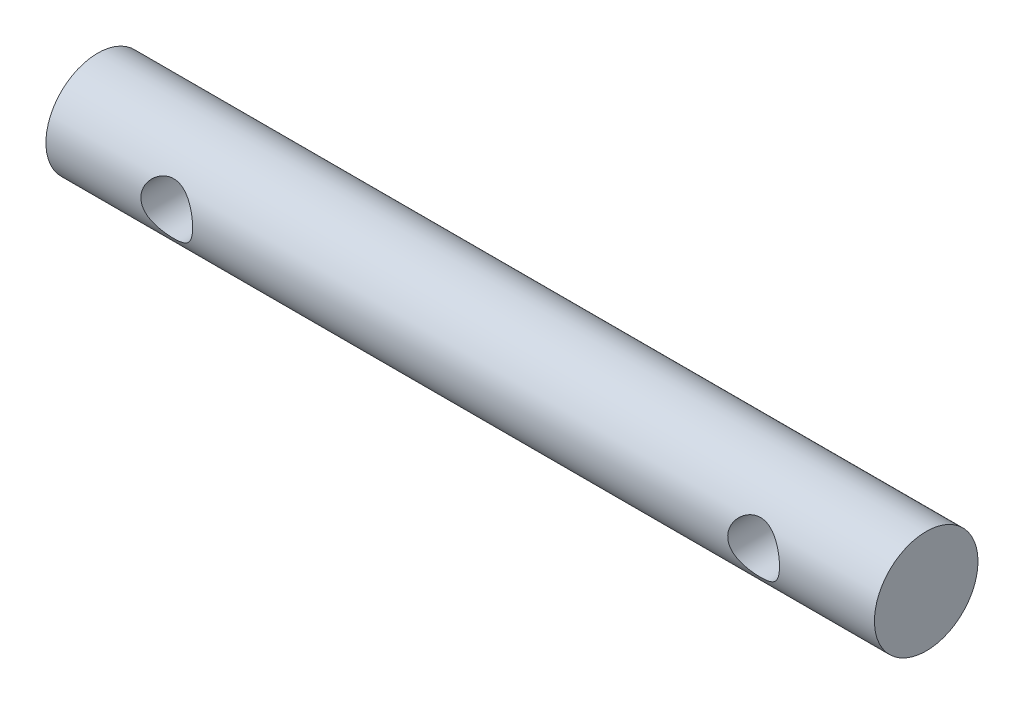
from build123d import *

# Parameters (mm, degrees)
SKETCH1_R               = 3
BOSS_EXTRUDE1_DEPTH     = 48
CUT_EXTRUDE1_DEPTH      = 49.187135213
CUT_EXTRUDE1_DEPTH_BACK = 49.187135213
SKETCH2_R               = 1.5


with BuildPart() as part:
    # Sketch1 → Boss-Extrude1 (new body)
    with BuildSketch(Plane.YZ):
        with Locations(Location((0, 0, 0), (0, 0, 270))):
            Circle(SKETCH1_R)
    extrude(amount=BOSS_EXTRUDE1_DEPTH)

    # Sketch2 → Cut-Extrude1 (cut, two sides: drawn at the far end of the back side and taken through both)
    with BuildSketch(Plane(origin=(0, 0, 0), x_dir=(0, 1, 0), z_dir=(0, 0, 1)).offset(-CUT_EXTRUDE1_DEPTH_BACK)):
        with Locations(Location((0, -41, 0), (0, 0, 270))):
            Circle(SKETCH2_R)
        with Locations(Location((0, -7, 0), (0, 0, 270))):
            Circle(SKETCH2_R)
    extrude(amount=CUT_EXTRUDE1_DEPTH + CUT_EXTRUDE1_DEPTH_BACK, mode=Mode.SUBTRACT)


solid = part.part
